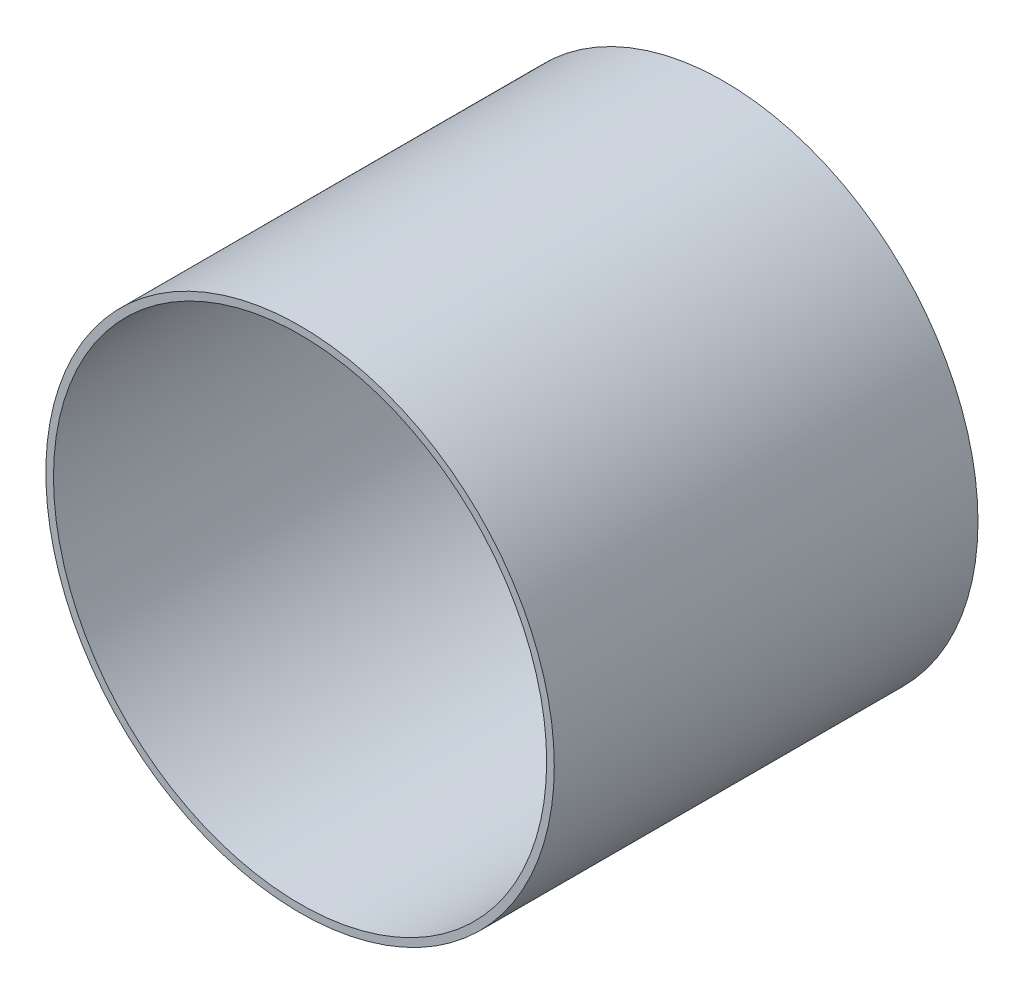
from build123d import *

# Parameters (mm, degrees)
SKETCH1_R           = 15
SKETCH1_R_2         = 14.55
BOSS_EXTRUDE1_DEPTH = 25


with BuildPart() as part:
    # Sketch1 → Boss-Extrude1 (new body)
    with BuildSketch(Plane.XY):
        Circle(SKETCH1_R)
        Circle(SKETCH1_R_2, mode=Mode.SUBTRACT)
    extrude(amount=BOSS_EXTRUDE1_DEPTH)


solid = part.part
